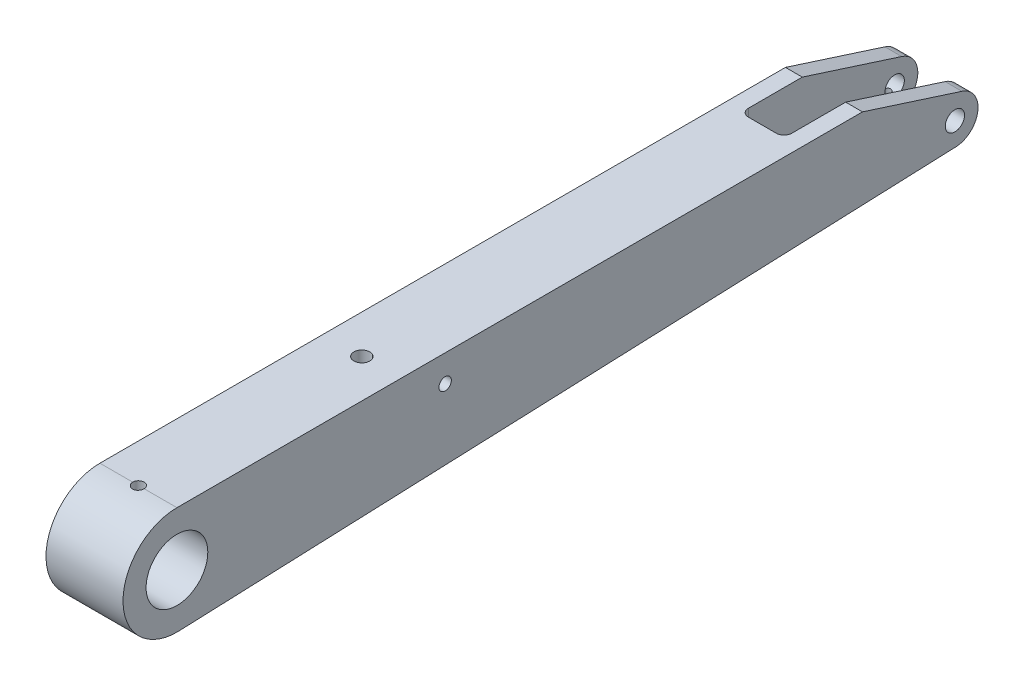
from build123d import *

# Parameters (mm, degrees)
BODY_DEPTH                 = 15.875
SKETCH2_R                  = 12.7254
F_1_002_HOLE_DEPTH         = 333.466619565
SKETCH3_R                  = 3.96748
F_3124_HOLE_DEPTH          = 333.466619565
SLOT_DEPTH                 = 25.4
ANGULAR_CLEARANCE_DEPTH    = 8.9408
SKETCH6_R                  = 2.3749
PIN_HOLE_DEPTH             = 25.4
F_5_16_18_TAPPED_HOLE1_D   = 6.5278
F_1_4_20_TAPPED_HOLE1_D    = 5.1054
F_8_32_TAPPED_HOLE1_REACH  = 334.421
F_8_32_TAPPED_HOLE1_BORE_R = 1.7272


with BuildPart() as part:
    # Sketch1 → BODY (new, symmetric)
    with BuildSketch(Plane(origin=(0, 0, 0), x_dir=(0, 0, -1), z_dir=(1, 0, 0))):
        with BuildLine():
            Line((0, 22.225), (282.575, 22.225))
            Line((282.575, 22.225), (323.58444924, 9.069770125))
            ThreePointArc((323.58444924, 9.069770125), (330.112821091, -1.285751941), (321.052227723, -9.517527213))
            Line((321.052227723, -9.517527213), (0.88019802, -22.207563496))
            ThreePointArc((0.88019802, -22.207563496), (-22.220640447, -0.440185355), (0, 22.225))
        make_face()
    extrude(amount=BODY_DEPTH, both=True)

    # Sketch2 → 1.002 HOLE (cut, through all)
    with BuildSketch(Plane(origin=(15.875, 0, 0), x_dir=(0, 0, -1), z_dir=(1, 0, 0))):
        Circle(SKETCH2_R)
    extrude(amount=-F_1_002_HOLE_DEPTH, mode=Mode.SUBTRACT)

    # Sketch3 → .3124 HOLE (cut, through all)
    with BuildSketch(Plane(origin=(15.875, 0, 0), x_dir=(0, 0, -1), z_dir=(1, 0, 0))):
        with Locations((320.675, 0)):
            Circle(SKETCH3_R)
    extrude(amount=-F_3124_HOLE_DEPTH, mode=Mode.SUBTRACT)

    # Sketch4 → SLOT (cut, symmetric)
    with BuildSketch(Plane(origin=(0, 0, 0), x_dir=(1, 0, 0), z_dir=(0, 1, 0))):
        with BuildLine():
            Line((-8.9408, 336.55), (8.9408, 336.55))
            Line((8.9408, 336.55), (8.9408, 260.35))
            ThreePointArc((8.9408, 260.35), (8.01086403, 258.10493597), (5.7658, 257.175))
            Line((5.7658, 257.175), (-5.7658, 257.175))
            ThreePointArc((-5.7658, 257.175), (-8.01086403, 258.10493597), (-8.9408, 260.35))
            Line((-8.9408, 260.35), (-8.9408, 336.55))
        make_face()
    extrude(amount=SLOT_DEPTH, both=True, mode=Mode.SUBTRACT)

    # Sketch5 → ANGULAR CLEARANCE (cut, symmetric)
    with BuildSketch(Plane(origin=(0, 0, 0), x_dir=(0, 0, -1), z_dir=(1, 0, 0))):
        Polygon((263.525, -2.529744374), (234.95, -12.930193819), (263.525, -11.797622097), align=None)
    extrude(amount=ANGULAR_CLEARANCE_DEPTH, both=True, mode=Mode.SUBTRACT)

    # Sketch6 → PIN HOLE (cut, symmetric)
    with BuildSketch(Plane(origin=(0, 0, 0), x_dir=(1, 0, 0), z_dir=(0, 1, 0))):
        with Locations(Location((0, 0, 0), (0, 0, 270))):
            Circle(SKETCH6_R)
    extrude(amount=PIN_HOLE_DEPTH, both=True, mode=Mode.SUBTRACT)

    # 5/16-18 Tapped Hole1 (through all)
    with Locations(Plane(origin=(0, 22.225, 0), x_dir=(-1, 0, 0), z_dir=(0, 1, 0))):
        with Locations((0, -92.075)):
            Hole(F_5_16_18_TAPPED_HOLE1_D / 2)

    # 1/4-20 Tapped Hole1 (through all)
    with Locations(Plane(origin=(15.875, 0, 0), x_dir=(0, 0, -1), z_dir=(1, 0, 0))):
        with Locations((110.562035551, 11.171477956)):
            Hole(F_1_4_20_TAPPED_HOLE1_D / 2)

    # #8-32 Tapped Hole1 bore → #8-32 Tapped Hole1 (cut, up to next)
    with BuildSketch(Plane(origin=(0, -12.7, 0), x_dir=(-1, 0, 0), z_dir=(0, -1, 0)), mode=Mode.PRIVATE) as f_8_32_tapped_hole1_sk1:
        with Locations((12.3952, 320.675)):
            Circle(F_8_32_TAPPED_HOLE1_BORE_R)
    f_8_32_tapped_hole1_tool1 = extrude(f_8_32_tapped_hole1_sk1.sketch, amount=-F_8_32_TAPPED_HOLE1_REACH, mode=Mode.PRIVATE) & part.part
    add(f_8_32_tapped_hole1_tool1.solids().sort_by_distance((-12.3952, -12.7, -320.675))[0], mode=Mode.SUBTRACT)


solid = part.part
